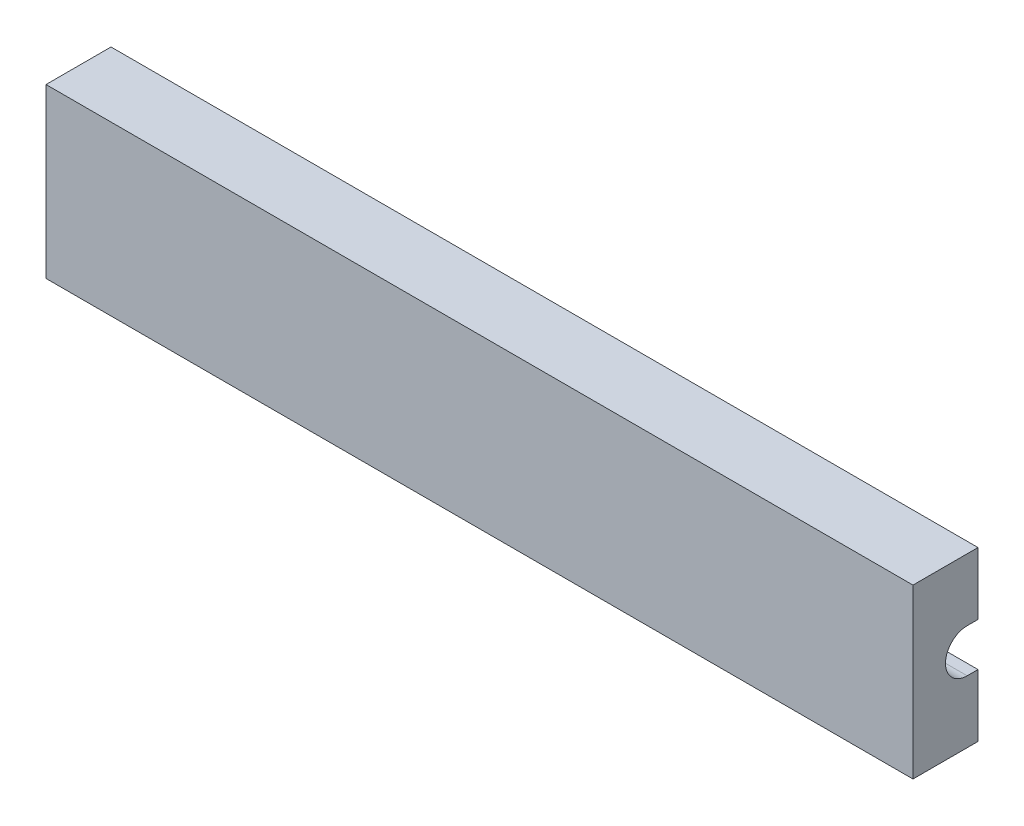
from build123d import *

# Parameters (mm, degrees)
BOSS_EXTRUDE1_DEPTH      = 60
BOSS_EXTRUDE1_DEPTH_BACK = 20


with BuildPart() as part:
    # Sketch1 → Boss-Extrude1 (new, two sides: drawn at the far end of the back side and taken through both)
    with BuildSketch(Plane(origin=(190.645148, 0, 0), x_dir=(0, 0, -1), z_dir=(1, 0, 0)).offset(-BOSS_EXTRUDE1_DEPTH_BACK)):
        with BuildLine():
            Line((-240.970904961, 189.163538159), (-246.970904961, 189.163538159))
            Line((-246.970904961, 189.163538159), (-246.970904961, 173.663538158))
            Line((-246.970904961, 173.663538158), (-240.970904961, 173.663538158))
            Line((-240.970904961, 173.663538158), (-240.970904961, 179.413538158))
            Line((-240.970904961, 179.413538158), (-241.970904961, 179.413538158))
            ThreePointArc((-241.970904961, 179.413538158), (-243.970904961, 181.413538158), (-241.970904961, 183.413538158))
            Line((-241.970904961, 183.413538158), (-240.970904961, 183.413538158))
            Line((-240.970904961, 183.413538158), (-240.970904961, 189.163538159))
        make_face()
    extrude(amount=BOSS_EXTRUDE1_DEPTH + BOSS_EXTRUDE1_DEPTH_BACK)


solid = part.part
